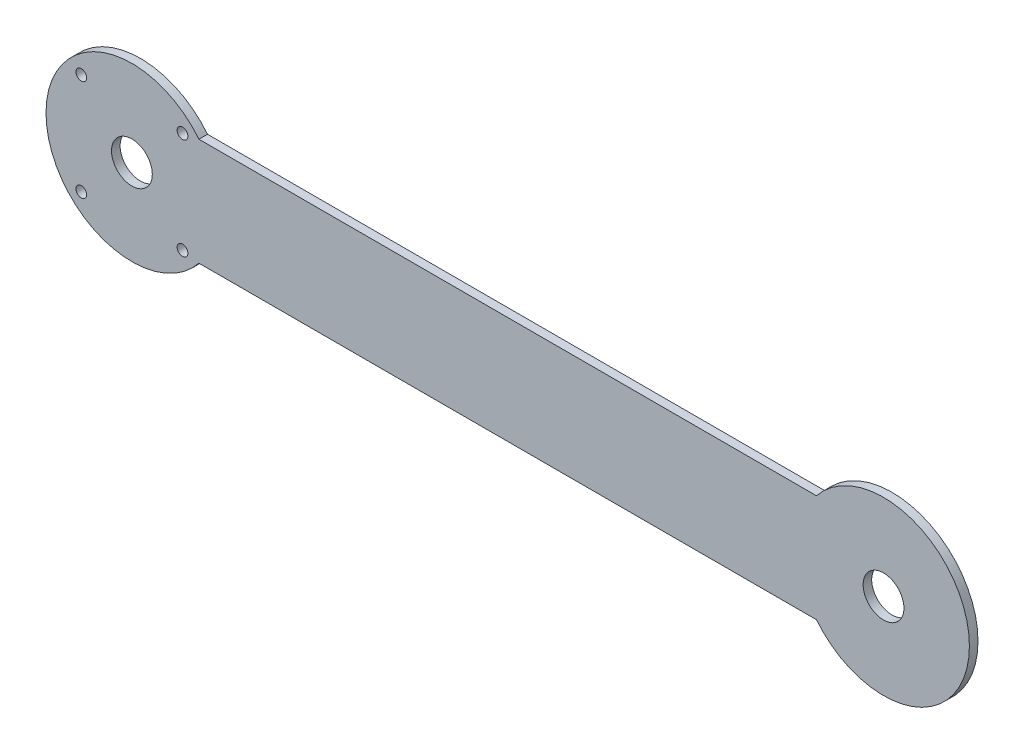
from build123d import *

# Parameters (mm, degrees)
SKETCH_1_R      = 2.5
SKETCH_1_R_2    = 9.5
EXTRUDE_1_DEPTH = 4


with BuildPart() as part:
    # 草图1 → 凸台-拉伸1 (new body)
    with BuildSketch(Plane.XY):
        with BuildLine():
            Line((31.224989992, 25), (318.775010008, 25))
            ThreePointArc((318.775010008, 25), (390, 0), (318.775010008, -25))
            Line((318.775010008, -25), (31.224989992, -25))
            ThreePointArc((31.224989992, -25), (-40, 0), (31.224989992, 25))
        make_face()
        with Locations((-23.57, 23.57)):
            Circle(SKETCH_1_R, mode=Mode.SUBTRACT)
        with Locations((23.57, 23.57)):
            Circle(SKETCH_1_R, mode=Mode.SUBTRACT)
        with Locations((23.57, -23.57)):
            Circle(SKETCH_1_R, mode=Mode.SUBTRACT)
        with Locations((-23.57, -23.57)):
            Circle(SKETCH_1_R, mode=Mode.SUBTRACT)
        with Locations((350, 0)):
            Circle(SKETCH_1_R_2, mode=Mode.SUBTRACT)
        Circle(SKETCH_1_R_2, mode=Mode.SUBTRACT)
    extrude(amount=EXTRUDE_1_DEPTH)


solid = part.part
